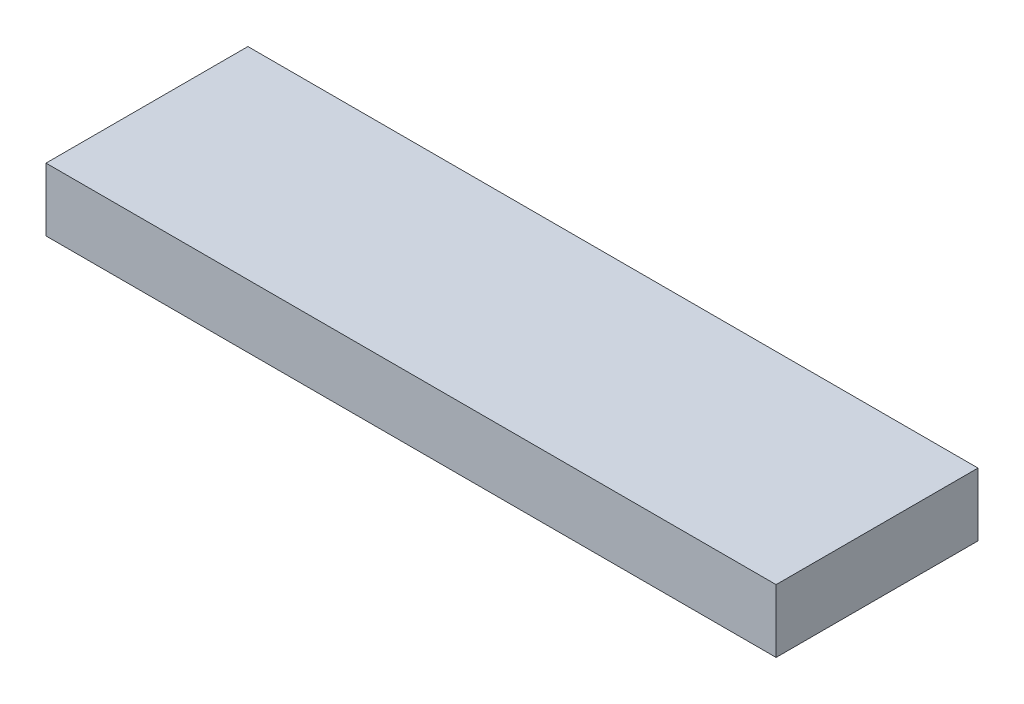
from build123d import *

# Parameters (mm, degrees)
SKETCH_1_W      = 40.5
SKETCH_1_H      = 11.2
EXTRUDE_1_DEPTH = 3.5


with BuildPart() as part:
    # Эскиз1 → Бобышка-Вытянуть1 (new body)
    with BuildSketch(Plane(origin=(0, 0, 0), x_dir=(1, 0, 0), z_dir=(0, 1, 0))):
        Rectangle(SKETCH_1_W, SKETCH_1_H)
    extrude(amount=EXTRUDE_1_DEPTH)


solid = part.part
